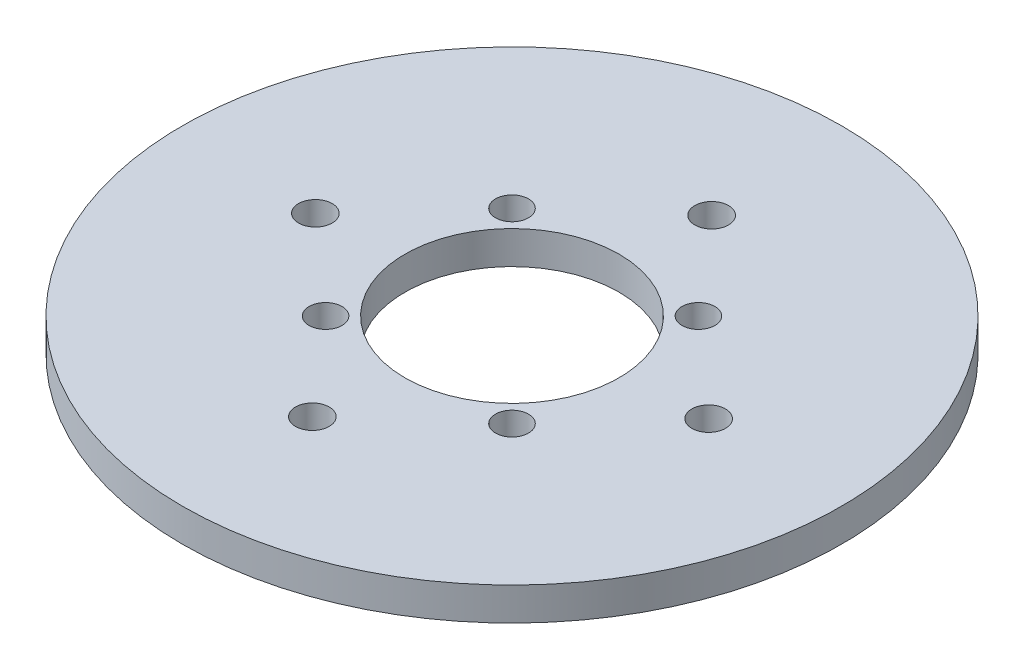
from build123d import *

# Parameters (mm, degrees)
SKETCH1_R           = 63.5
BOSS_EXTRUDE1_DEPTH = 6.35
SKETCH2_R           = 20.6375
CUT_EXTRUDE1_DEPTH  = 91.02678768
SKETCH3_R           = 3.175
CUT_EXTRUDE2_DEPTH  = 91.02678768
SKETCH4_R           = 3.25
CUT_EXTRUDE3_DEPTH  = 91.02678768


with BuildPart() as part:
    # Sketch1 → Boss-Extrude1 (new body)
    with BuildSketch(Plane(origin=(0, 0, 0), x_dir=(1, 0, 0), z_dir=(0, 1, 0))):
        with Locations(Location((0, 0, 0), (0, 0, 270))):
            Circle(SKETCH1_R)
    extrude(amount=BOSS_EXTRUDE1_DEPTH)

    # Sketch2 → Cut-Extrude1 (cut, through all)
    with BuildSketch(Plane(origin=(0, 6.35, 0), x_dir=(1, 0, 0), z_dir=(0, 1, 0))):
        with Locations(Location((0, 0, 0), (0, 0, 270))):
            Circle(SKETCH2_R)
    extrude(amount=-CUT_EXTRUDE1_DEPTH, mode=Mode.SUBTRACT)

    # Sketch3 → Cut-Extrude2 (cut, through all)
    with BuildSketch(Plane(origin=(0, 6.35, 0), x_dir=(1, 0, 0), z_dir=(0, 1, 0))):
        with Locations(Location((-17.960512242, 17.960512242, 0), (0, 0, 270))):
            Circle(SKETCH3_R)
        with Locations(Location((17.960512242, 17.960512242, 0), (0, 0, 270))):
            Circle(SKETCH3_R)
        with Locations(Location((17.960512242, -17.960512242, 0), (0, 0, 270))):
            Circle(SKETCH3_R)
        with Locations(Location((-17.960512242, -17.960512242, 0), (0, 0, 270))):
            Circle(SKETCH3_R)
    extrude(amount=-CUT_EXTRUDE2_DEPTH, mode=Mode.SUBTRACT)

    # Sketch4 → Cut-Extrude3 (cut, through all)
    with BuildSketch(Plane(origin=(0, 6.35, 0), x_dir=(1, 0, 0), z_dir=(0, 1, 0))):
        with Locations(Location((-36.079282025, -1.812569594, 0), (0, 0, 270))):
            Circle(SKETCH4_R)
        with Locations(Location((2.429915675, 36.04296755, 0), (0, 0, 270))):
            Circle(SKETCH4_R)
        with Locations(Location((36.079282025, 1.812569594, 0), (0, 0, 270))):
            Circle(SKETCH4_R)
        with Locations(Location((-2.429915675, -36.04296755, 0), (0, 0, 270))):
            Circle(SKETCH4_R)
    extrude(amount=-CUT_EXTRUDE3_DEPTH, mode=Mode.SUBTRACT)


solid = part.part
